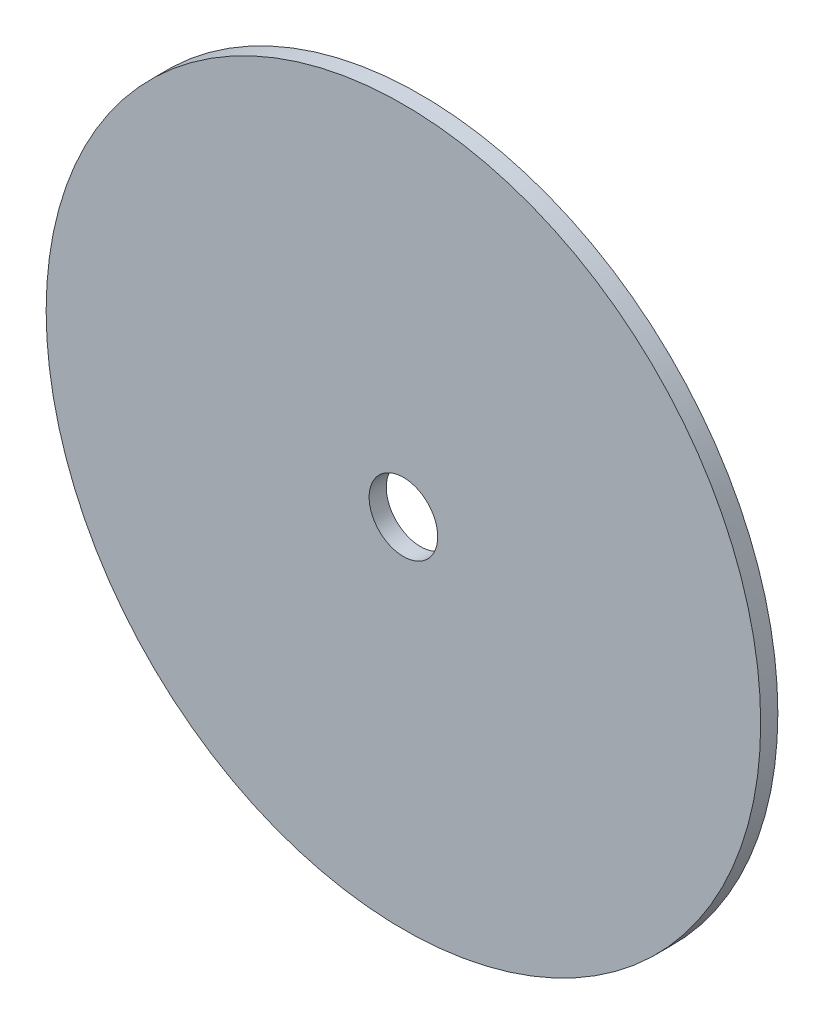
from build123d import *

# Parameters (mm, degrees)
SKETCH1_R           = 62.5
SKETCH1_R_2         = 6
BOSS_EXTRUDE1_DEPTH = 3


with BuildPart() as part:
    # Sketch1 → Boss-Extrude1 (new body)
    with BuildSketch(Plane.XY):
        Circle(SKETCH1_R)
        Circle(SKETCH1_R_2, mode=Mode.SUBTRACT)
    extrude(amount=BOSS_EXTRUDE1_DEPTH)


solid = part.part
